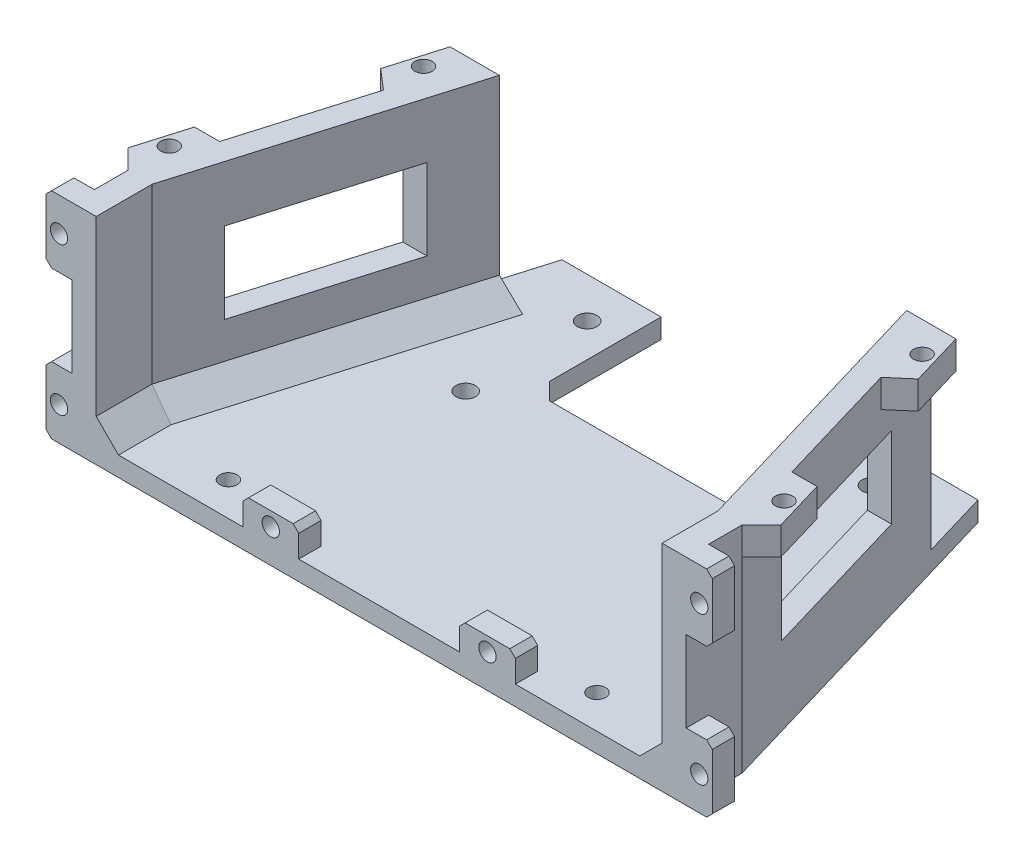
from build123d import *

# Parameters (mm, degrees)
BOSS_EXTRUDE1_DEPTH = 3.5
FILLET1_SIZE        = 3
SKETCH4_W           = 4.33
SKETCH4_H           = 10
BOSS_EXTRUDE2_DEPTH = 35
SKETCH5_W           = 10
SKETCH5_H           = 5
SKETCH5_R           = 1.55
SKETCH5_W_2         = 4.658740085
SKETCH5_H_2         = 12
BOSS_EXTRUDE3_DEPTH = 4
FILLET2_SIZE        = 1
CUT_EXTRUDE1_DEPTH  = 14
BOSS_EXTRUDE4_DEPTH = 35
SKETCH9_W           = 28
SKETCH9_H           = 14.5
CUT_EXTRUDE2_DEPTH  = 117
SKETCH10_R          = 1.75
CUT_EXTRUDE3_DEPTH  = 117
FILLET3_SIZE        = 4
SKETCH11_R          = 1.55
CUT_EXTRUDE4_DEPTH  = 95
SKETCH12_R          = 1.55
BOSS_EXTRUDE5_DEPTH = 5


with BuildPart() as part:
    # Sketch1 → Boss-Extrude1 (new body)
    with BuildSketch(Plane(origin=(0, 0, 0), x_dir=(1, 0, 0), z_dir=(0, 1, 0))):
        Polygon((35.5, 70), (35.5, 46.99950249), (74.5, 46.99950249), (74.5, 70), (110, 70), (110, 0), (0, 0), (0, 70), align=None)
    extrude(amount=BOSS_EXTRUDE1_DEPTH)

    # Fillet1
    fillet1_edges = [part.edges().sort_by_distance(p)[0] for p in [
        (35.5, 1.75, -46.99950249),
        (74.5, 1.75, -46.99950249),
    ]]
    chamfer(fillet1_edges, length=FILLET1_SIZE)

    # Sketch4 → Boss-Extrude2 (add)
    with BuildSketch(Plane(origin=(0, 3.5, 0), x_dir=(1, 0, 0), z_dir=(0, 1, 0))):
        with Locations((107.835, 5)):
            Rectangle(SKETCH4_W, SKETCH4_H)
        with Locations((2.165, 5)):
            Rectangle(SKETCH4_W, SKETCH4_H)
    extrude(amount=BOSS_EXTRUDE2_DEPTH)

    # Sketch5 → Boss-Extrude3 (add)
    # profile 1 of 6: a face of its own
    with BuildSketch(Plane.XY):
        with Locations((35.6, 6)):
            Rectangle(SKETCH5_W, SKETCH5_H)
        with Locations((35.6, 6)):
            Circle(SKETCH5_R, mode=Mode.SUBTRACT)
    # profile 2 of 6: a face of its own
    with BuildSketch(Plane.XY):
        with Locations((-2.329370043, 32.5)):
            Rectangle(SKETCH5_W_2, SKETCH5_H_2)
        with Locations((-2.329370042, 32.5)):
            Circle(SKETCH5_R, mode=Mode.SUBTRACT)
    # profile 3 of 6: a face of its own
    with BuildSketch(Plane.XY):
        with Locations((-2.329370043, 6)):
            Rectangle(SKETCH5_W_2, SKETCH5_H_2)
        with Locations((-2.329370042, 6)):
            Circle(SKETCH5_R, mode=Mode.SUBTRACT)
    # profile 4 of 6: a face of its own
    with BuildSketch(Plane.XY):
        with Locations((74.4, 6)):
            Rectangle(SKETCH5_W, SKETCH5_H)
        with Locations(Location((74.4, 6, 0), (0, 0, 180))):
            Circle(SKETCH5_R, mode=Mode.SUBTRACT)
    # profile 5 of 6: a face of its own
    with BuildSketch(Plane.XY):
        with Locations((112.329370043, 6)):
            Rectangle(SKETCH5_W_2, SKETCH5_H_2)
        with Locations(Location((112.329370042, 6, 0), (0, 0, 180))):
            Circle(SKETCH5_R, mode=Mode.SUBTRACT)
    # profile 6 of 6: a face of its own
    with BuildSketch(Plane.XY):
        with Locations((112.329370043, 32.5)):
            Rectangle(SKETCH5_W_2, SKETCH5_H_2)
        with Locations(Location((112.329370042, 32.5, 0), (0, 0, 180))):
            Circle(SKETCH5_R, mode=Mode.SUBTRACT)
    extrude(amount=-BOSS_EXTRUDE3_DEPTH)

    # Fillet2
    fillet2_edges = [part.edges().sort_by_distance(p)[0] for p in [
        (69.4, 8.5, -2),
        (79.4, 8.5, -2),
        (114.658740085, 12, -2),
        (114.658740085, 0, -2),
        (114.658740085, 38.5, -2),
        (114.658740085, 26.5, -2),
        (40.6, 8.5, -2),
        (30.6, 8.5, -2),
        (-4.658740085, 26.5, -2),
        (-4.658740085, 38.5, -2),
        (-4.658740085, 0, -2),
        (-4.658740085, 12, -2),
    ]]
    chamfer(fillet2_edges, length=FILLET2_SIZE)

    # Sketch6 → Cut-Extrude1 (cut)
    with BuildSketch(Plane(origin=(0, 3.5, 0), x_dir=(1, 0, 0), z_dir=(0, 1, 0))):
        Polygon((0, 10), (17.75, 70), (0, 70), align=None)
        Polygon((110, 70), (92.25, 70), (110, 10), align=None)
    extrude(amount=-CUT_EXTRUDE1_DEPTH, mode=Mode.SUBTRACT)

    # Sketch8 → Boss-Extrude4 (add)
    with BuildSketch(Plane(origin=(0, 3.5, 0), x_dir=(1, 0, 0), z_dir=(0, 1, 0))):
        Polygon((0, 10), (14.2, 58), (18.53, 58), (4.33, 10), align=None)
        Polygon((91.47, 58), (105.67, 10), (110, 10), (95.8, 58), align=None)
    extrude(amount=BOSS_EXTRUDE4_DEPTH)

    # Sketch9 → Cut-Extrude2 (cut)
    with BuildSketch(Plane.ZY):
        with Locations((-34, 21.25)):
            Rectangle(SKETCH9_W, SKETCH9_H)
    extrude(amount=-CUT_EXTRUDE2_DEPTH, mode=Mode.SUBTRACT)

    # Sketch10 → Cut-Extrude3 (cut)
    with BuildSketch(Plane(origin=(0, 3.5, 0), x_dir=(1, 0, 0), z_dir=(0, 1, 0))):
        with Locations(Location((80.5, 62.75, 0), (0, 0, 270))):
            Circle(SKETCH10_R)
        with Locations(Location((80.5, 41, 0), (0, 0, 270))):
            Circle(SKETCH10_R)
        with Locations(Location((29.5, 41, 0), (0, 0, 90))):
            Circle(SKETCH10_R)
        with Locations(Location((29.5, 62.75, 0), (0, 0, 90))):
            Circle(SKETCH10_R)
    extrude(amount=-CUT_EXTRUDE3_DEPTH, mode=Mode.SUBTRACT)

    # Fillet3
    fillet3_edges = [part.edges().sort_by_distance(p)[0] for p in [
        (11.43, 3.5, -34),
        (98.57, 3.5, -34),
        (4.33, 3.5, -5),
        (105.67, 3.5, -5),
    ]]
    chamfer(fillet3_edges, length=FILLET3_SIZE)

    # Sketch11 → Cut-Extrude4 (cut)
    with BuildSketch(Plane(origin=(0, 38.5, 0), x_dir=(1, 0, 0), z_dir=(0, 1, 0))):
        with Locations(Location((88, 6.01, 0), (0, 0, 270))):
            Circle(SKETCH11_R)
        with Locations(Location((22, 6.01, 0), (0, 0, 270))):
            Circle(SKETCH11_R)
    extrude(amount=-CUT_EXTRUDE4_DEPTH, mode=Mode.SUBTRACT)

    # Sketch12 → Boss-Extrude5 (add)
    # profile 1 of 4: a face of its own
    with BuildSketch(Plane(origin=(0, 38.5, 0), x_dir=(1, 0, 0), z_dir=(0, 1, 0))):
        Polygon((14.2, 58), (9.7, 58), (6.86319811, 48.410810512), (10.45001483, 45.323993792), (11.36319811, 48.410810512), align=None)
        with Locations(Location((10.350531543, 52.593346062, 0), (0, 0, 270))):
            Circle(SKETCH12_R, mode=Mode.SUBTRACT)
    # profile 2 of 4: a face of its own
    with BuildSketch(Plane(origin=(0, 38.5, 0), x_dir=(1, 0, 0), z_dir=(0, 1, 0))):
        Polygon((3.75018599, 22.676685036), (0.9133841, 13.087495548), (0, 10), (-3.472442888, 13.473432491), (-0.74981401, 22.676685036), align=None)
        with Locations(Location((-0.042195961, 17.462999569, 0), (0, 0, 270))):
            Circle(SKETCH12_R, mode=Mode.SUBTRACT)
    # profile 3 of 4: a face of its own
    with BuildSketch(Plane(origin=(0, 38.5, 0), x_dir=(1, 0, 0), z_dir=(0, 1, 0))):
        Polygon((110.74981401, 22.676685036), (106.24981401, 22.676685036), (109.0866159, 13.087495548), (110, 10), (113.472442888, 13.473432491), align=None)
        with Locations(Location((110.042195961, 17.462999569, 0), (0, 0, 90))):
            Circle(SKETCH12_R, mode=Mode.SUBTRACT)
    # profile 4 of 4: a face of its own
    with BuildSketch(Plane(origin=(0, 38.5, 0), x_dir=(1, 0, 0), z_dir=(0, 1, 0))):
        Polygon((103.13680189, 48.410810512), (99.54998517, 45.323993792), (98.63680189, 48.410810512), (95.8, 58), (100.3, 58), align=None)
        with Locations(Location((99.649468457, 52.593346062, 0), (0, 0, 90))):
            Circle(SKETCH12_R, mode=Mode.SUBTRACT)
    extrude(amount=-BOSS_EXTRUDE5_DEPTH)


solid = part.part
